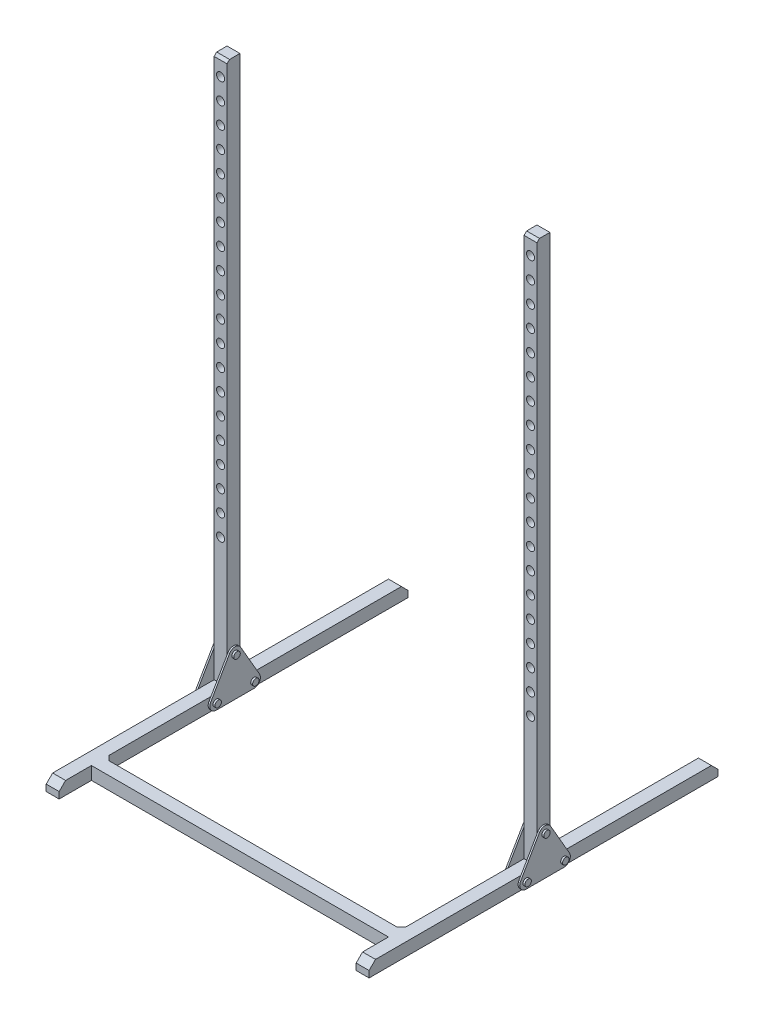
from build123d import *

# Parameters (mm, degrees)
SKETCH1_W                = 50.8
SKETCH1_H                = 50.8
BOSS_EXTRUDE1_DEPTH      = 1371.6
SKETCH2_W                = 50.8
SKETCH2_H                = 50.8
BOSS_EXTRUDE2_DEPTH      = 1168.4
SKETCH3_W                = 50.8
SKETCH3_H                = 50.8
BOSS_EXTRUDE3_DEPTH      = 2133.6
BOSS_EXTRUDE4_DEPTH      = 6.35
FILLET1_R                = 25.4
FILLET2_R                = 25.4
MIRROR4_COPY_1_DEPTH     = 6.35
FILLET3_R                = 25.4
CHAMFER1_SIZE            = 25.24
CHAMFER2_SIZE            = 17.62
SKETCH7_R                = 15.875
CUT_EXTRUDE1_DEPTH       = 2595.602540371
LPATTERN1_COUNT          = 20
LPATTERN1_PITCH          = 82.55
MIRROR5_COPY_1_SKETCH_R  = 15.875
MIRROR5_COPY_1_DEPTH     = 2595.602540371
MIRROR5_COPY_2_SKETCH_R  = 15.875
MIRROR5_COPY_2_DEPTH     = 2595.602540371
MIRROR5_COPY_3_SKETCH_R  = 15.875
MIRROR5_COPY_3_DEPTH     = 2595.602540371
MIRROR5_COPY_4_SKETCH_R  = 15.875
MIRROR5_COPY_4_DEPTH     = 2595.602540371
MIRROR5_COPY_5_SKETCH_R  = 15.875
MIRROR5_COPY_5_DEPTH     = 2595.602540371
MIRROR5_COPY_6_SKETCH_R  = 15.875
MIRROR5_COPY_6_DEPTH     = 2595.602540371
MIRROR5_COPY_7_SKETCH_R  = 15.875
MIRROR5_COPY_7_DEPTH     = 2595.602540371
MIRROR5_COPY_8_SKETCH_R  = 15.875
MIRROR5_COPY_8_DEPTH     = 2595.602540371
MIRROR5_COPY_9_SKETCH_R  = 15.875
MIRROR5_COPY_9_DEPTH     = 2595.602540371
MIRROR5_COPY_10_SKETCH_R = 15.875
MIRROR5_COPY_10_DEPTH    = 2595.602540371
MIRROR5_COPY_11_SKETCH_R = 15.875
MIRROR5_COPY_11_DEPTH    = 2595.602540371
MIRROR5_COPY_12_SKETCH_R = 15.875
MIRROR5_COPY_12_DEPTH    = 2595.602540371
MIRROR5_COPY_13_SKETCH_R = 15.875
MIRROR5_COPY_13_DEPTH    = 2595.602540371
MIRROR5_COPY_14_SKETCH_R = 15.875
MIRROR5_COPY_14_DEPTH    = 2595.602540371
MIRROR5_COPY_15_SKETCH_R = 15.875
MIRROR5_COPY_15_DEPTH    = 2595.602540371
MIRROR5_COPY_16_SKETCH_R = 15.875
MIRROR5_COPY_16_DEPTH    = 2595.602540371
MIRROR5_COPY_17_SKETCH_R = 15.875
MIRROR5_COPY_17_DEPTH    = 2595.602540371
MIRROR5_COPY_18_SKETCH_R = 15.875
MIRROR5_COPY_18_DEPTH    = 2595.602540371
MIRROR5_COPY_19_SKETCH_R = 15.875
MIRROR5_COPY_19_DEPTH    = 2595.602540371
SKETCH8_R                = 12.7
BOSS_EXTRUDE5_DEPTH      = 7.62
MIRROR7_COPY_1_SKETCH_R  = 12.7
MIRROR7_COPY_1_DEPTH     = 7.62
CHAMFER3_SIZE            = 10


with BuildPart() as part:
    # Sketch1 → Boss-Extrude1 (new body)
    with BuildSketch(Plane.XY):
        Rectangle(SKETCH1_W, SKETCH1_H)
    boss_extrude1 = extrude(amount=BOSS_EXTRUDE1_DEPTH)

    # Sketch2 → Boss-Extrude2 (add)
    with BuildSketch(Plane(origin=(25.4, 0, 0), x_dir=(0, 0, -1), z_dir=(1, 0, 0))):
        with Locations((-1219.228406196, 0)):
            Rectangle(SKETCH2_W, SKETCH2_H)
    extrude(amount=BOSS_EXTRUDE2_DEPTH)

    # Mirror1: Boss-Extrude1 across plane
    add(boss_extrude1.mirror(Plane(origin=(609.6, 0, 0), x_dir=(0, 0, 1), z_dir=(1, 0, 0))))

    # Sketch3 → Boss-Extrude3 (add)
    with BuildSketch(Plane(origin=(0, 25.4, 0), x_dir=(1, 0, 0), z_dir=(0, 1, 0))):
        with Locations((0, -685.8)):
            Rectangle(SKETCH3_W, SKETCH3_H)
    boss_extrude3 = extrude(amount=BOSS_EXTRUDE3_DEPTH)

    # Sketch4 → Boss-Extrude4 (add)
    with BuildSketch(Plane.ZY.offset(25.4)):
        Polygon((597.014082897, 25.4), (567.684689222, -25.4), (803.915310778, -25.4), (774.585917103, 25.4), (711.2, 25.4), (711.2, 135.187628907), (685.8, 179.181719419), (660.4, 135.187628907), (660.4, 25.4), align=None)
        Polygon((660.4, 135.187628907), (597.014082897, 25.4), (660.4, 25.4), align=None)
        Polygon((711.2, 25.4), (774.585917103, 25.4), (711.2, 135.187628907), align=None)
    boss_extrude4 = extrude(amount=BOSS_EXTRUDE4_DEPTH)

    # Fillet1
    fillet1_edges = [part.edges().sort_by_distance(p)[0] for p in [
        (-28.575, -25.4, 803.915310778),
        (-28.575, 179.181719419, 685.8),
        (-28.575, -25.4, 567.684689222),
    ]]
    fillet(fillet1_edges, radius=FILLET1_R)

    # Mirror2: Boss-Extrude4 across plane
    add(boss_extrude4.mirror(Plane(origin=(0, 0, 0), x_dir=(0, 0, 1), z_dir=(1, 0, 0))))

    # Fillet2
    fillet2_edges = [part.edges().sort_by_distance(p)[0] for p in [
        (28.575, 179.181719419, 685.8),
        (28.575, -25.4, 803.915310778),
        (28.575, -25.4, 567.684689222),
    ]]
    fillet(fillet2_edges, radius=FILLET2_R)

    # Mirror4: Boss-Extrude3, Boss-Extrude4 across plane
    add(boss_extrude3.mirror(Plane(origin=(609.6, 0, 0), x_dir=(0, 0, 1), z_dir=(1, 0, 0))))
    add(boss_extrude4.mirror(Plane(origin=(609.6, 0, 0), x_dir=(0, 0, 1), z_dir=(1, 0, 0))))

    # Mirror4 copy 1 sketch → Mirror4 copy 1 (add)
    with BuildSketch(Plane.ZY.offset(-1193.8)):
        Polygon((597.014082897, 25.4), (567.684689222, -25.4), (803.915310778, -25.4), (774.585917103, 25.4), (711.2, 25.4), (711.2, 135.187628907), (685.8, 179.181719419), (660.4, 135.187628907), (660.4, 25.4), align=None)
        Polygon((660.4, 135.187628907), (597.014082897, 25.4), (660.4, 25.4), align=None)
        Polygon((711.2, 25.4), (774.585917103, 25.4), (711.2, 135.187628907), align=None)
    extrude(amount=MIRROR4_COPY_1_DEPTH)

    # Fillet3
    fillet3_edges = [part.edges().sort_by_distance(p)[0] for p in [
        (1247.775, 179.181719419, 685.8),
        (1247.775, -25.4, 803.915310778),
        (1247.775, -25.4, 567.684689222),
        (1190.625, -25.4, 803.915310778),
        (1190.625, 179.181719419, 685.8),
        (1190.625, -25.4, 567.684689222),
    ]]
    fillet(fillet3_edges, radius=FILLET3_R)

    # Chamfer1
    chamfer1_edges = [part.edges().sort_by_distance(p)[0] for p in [
        (1219.2, 25.4, 1371.6),
        (1219.2, 25.4, 0),
        (0, 25.4, 0),
        (0, 25.4, 1371.6),
    ]]
    chamfer(chamfer1_edges, length=CHAMFER1_SIZE)

    # Chamfer2
    chamfer2_edges = [part.edges().sort_by_distance(p)[0] for p in [
        (25.4, 0, 1193.828406196),
        (1193.8, 0, 1193.828406196),
    ]]
    chamfer(chamfer2_edges, length=CHAMFER2_SIZE)

    # Sketch7 → Cut-Extrude1 (cut, through all)
    with BuildSketch(Plane(origin=(0, 0, 660.4), x_dir=(-1, 0, 0), z_dir=(0, 0, -1))):
        with Locations((0, 2092.325)):
            Circle(SKETCH7_R)
    cut_extrude1 = extrude(amount=-CUT_EXTRUDE1_DEPTH, mode=Mode.SUBTRACT)

    # LPattern1: Cut-Extrude1 ×20
    with Locations(*[(0, -i * LPATTERN1_PITCH, 0) for i in range(1, LPATTERN1_COUNT)]):
        add(cut_extrude1, mode=Mode.SUBTRACT)

    # Mirror5: Cut-Extrude1 across plane
    add(cut_extrude1.mirror(Plane(origin=(609.6, 0, 0), x_dir=(0, 0, 1), z_dir=(1, 0, 0))), mode=Mode.SUBTRACT)

    # Mirror5 copy 1 sketch → Mirror5 copy 1 (cut, through all)
    with BuildSketch(Plane(origin=(1219.2, -82.55, 660.4), x_dir=(1, 0, 0), z_dir=(0, 0, -1))):
        with Locations((0, -2092.325)):
            Circle(MIRROR5_COPY_1_SKETCH_R)
    extrude(amount=-MIRROR5_COPY_1_DEPTH, mode=Mode.SUBTRACT)

    # Mirror5 copy 2 sketch → Mirror5 copy 2 (cut, through all)
    with BuildSketch(Plane(origin=(1219.2, -165.1, 660.4), x_dir=(1, 0, 0), z_dir=(0, 0, -1))):
        with Locations((0, -2092.325)):
            Circle(MIRROR5_COPY_2_SKETCH_R)
    extrude(amount=-MIRROR5_COPY_2_DEPTH, mode=Mode.SUBTRACT)

    # Mirror5 copy 3 sketch → Mirror5 copy 3 (cut, through all)
    with BuildSketch(Plane(origin=(1219.2, -247.65, 660.4), x_dir=(1, 0, 0), z_dir=(0, 0, -1))):
        with Locations((0, -2092.325)):
            Circle(MIRROR5_COPY_3_SKETCH_R)
    extrude(amount=-MIRROR5_COPY_3_DEPTH, mode=Mode.SUBTRACT)

    # Mirror5 copy 4 sketch → Mirror5 copy 4 (cut, through all)
    with BuildSketch(Plane(origin=(1219.2, -330.2, 660.4), x_dir=(1, 0, 0), z_dir=(0, 0, -1))):
        with Locations((0, -2092.325)):
            Circle(MIRROR5_COPY_4_SKETCH_R)
    extrude(amount=-MIRROR5_COPY_4_DEPTH, mode=Mode.SUBTRACT)

    # Mirror5 copy 5 sketch → Mirror5 copy 5 (cut, through all)
    with BuildSketch(Plane(origin=(1219.2, -412.75, 660.4), x_dir=(1, 0, 0), z_dir=(0, 0, -1))):
        with Locations((0, -2092.325)):
            Circle(MIRROR5_COPY_5_SKETCH_R)
    extrude(amount=-MIRROR5_COPY_5_DEPTH, mode=Mode.SUBTRACT)

    # Mirror5 copy 6 sketch → Mirror5 copy 6 (cut, through all)
    with BuildSketch(Plane(origin=(1219.2, -495.3, 660.4), x_dir=(1, 0, 0), z_dir=(0, 0, -1))):
        with Locations((0, -2092.325)):
            Circle(MIRROR5_COPY_6_SKETCH_R)
    extrude(amount=-MIRROR5_COPY_6_DEPTH, mode=Mode.SUBTRACT)

    # Mirror5 copy 7 sketch → Mirror5 copy 7 (cut, through all)
    with BuildSketch(Plane(origin=(1219.2, -577.85, 660.4), x_dir=(1, 0, 0), z_dir=(0, 0, -1))):
        with Locations((0, -2092.325)):
            Circle(MIRROR5_COPY_7_SKETCH_R)
    extrude(amount=-MIRROR5_COPY_7_DEPTH, mode=Mode.SUBTRACT)

    # Mirror5 copy 8 sketch → Mirror5 copy 8 (cut, through all)
    with BuildSketch(Plane(origin=(1219.2, -660.4, 660.4), x_dir=(1, 0, 0), z_dir=(0, 0, -1))):
        with Locations((0, -2092.325)):
            Circle(MIRROR5_COPY_8_SKETCH_R)
    extrude(amount=-MIRROR5_COPY_8_DEPTH, mode=Mode.SUBTRACT)

    # Mirror5 copy 9 sketch → Mirror5 copy 9 (cut, through all)
    with BuildSketch(Plane(origin=(1219.2, -742.95, 660.4), x_dir=(1, 0, 0), z_dir=(0, 0, -1))):
        with Locations((0, -2092.325)):
            Circle(MIRROR5_COPY_9_SKETCH_R)
    extrude(amount=-MIRROR5_COPY_9_DEPTH, mode=Mode.SUBTRACT)

    # Mirror5 copy 10 sketch → Mirror5 copy 10 (cut, through all)
    with BuildSketch(Plane(origin=(1219.2, -825.5, 660.4), x_dir=(1, 0, 0), z_dir=(0, 0, -1))):
        with Locations((0, -2092.325)):
            Circle(MIRROR5_COPY_10_SKETCH_R)
    extrude(amount=-MIRROR5_COPY_10_DEPTH, mode=Mode.SUBTRACT)

    # Mirror5 copy 11 sketch → Mirror5 copy 11 (cut, through all)
    with BuildSketch(Plane(origin=(1219.2, -908.05, 660.4), x_dir=(1, 0, 0), z_dir=(0, 0, -1))):
        with Locations((0, -2092.325)):
            Circle(MIRROR5_COPY_11_SKETCH_R)
    extrude(amount=-MIRROR5_COPY_11_DEPTH, mode=Mode.SUBTRACT)

    # Mirror5 copy 12 sketch → Mirror5 copy 12 (cut, through all)
    with BuildSketch(Plane(origin=(1219.2, -990.6, 660.4), x_dir=(1, 0, 0), z_dir=(0, 0, -1))):
        with Locations((0, -2092.325)):
            Circle(MIRROR5_COPY_12_SKETCH_R)
    extrude(amount=-MIRROR5_COPY_12_DEPTH, mode=Mode.SUBTRACT)

    # Mirror5 copy 13 sketch → Mirror5 copy 13 (cut, through all)
    with BuildSketch(Plane(origin=(1219.2, -1073.15, 660.4), x_dir=(1, 0, 0), z_dir=(0, 0, -1))):
        with Locations((0, -2092.325)):
            Circle(MIRROR5_COPY_13_SKETCH_R)
    extrude(amount=-MIRROR5_COPY_13_DEPTH, mode=Mode.SUBTRACT)

    # Mirror5 copy 14 sketch → Mirror5 copy 14 (cut, through all)
    with BuildSketch(Plane(origin=(1219.2, -1155.7, 660.4), x_dir=(1, 0, 0), z_dir=(0, 0, -1))):
        with Locations((0, -2092.325)):
            Circle(MIRROR5_COPY_14_SKETCH_R)
    extrude(amount=-MIRROR5_COPY_14_DEPTH, mode=Mode.SUBTRACT)

    # Mirror5 copy 15 sketch → Mirror5 copy 15 (cut, through all)
    with BuildSketch(Plane(origin=(1219.2, -1238.25, 660.4), x_dir=(1, 0, 0), z_dir=(0, 0, -1))):
        with Locations((0, -2092.325)):
            Circle(MIRROR5_COPY_15_SKETCH_R)
    extrude(amount=-MIRROR5_COPY_15_DEPTH, mode=Mode.SUBTRACT)

    # Mirror5 copy 16 sketch → Mirror5 copy 16 (cut, through all)
    with BuildSketch(Plane(origin=(1219.2, -1320.8, 660.4), x_dir=(1, 0, 0), z_dir=(0, 0, -1))):
        with Locations((0, -2092.325)):
            Circle(MIRROR5_COPY_16_SKETCH_R)
    extrude(amount=-MIRROR5_COPY_16_DEPTH, mode=Mode.SUBTRACT)

    # Mirror5 copy 17 sketch → Mirror5 copy 17 (cut, through all)
    with BuildSketch(Plane(origin=(1219.2, -1403.35, 660.4), x_dir=(1, 0, 0), z_dir=(0, 0, -1))):
        with Locations((0, -2092.325)):
            Circle(MIRROR5_COPY_17_SKETCH_R)
    extrude(amount=-MIRROR5_COPY_17_DEPTH, mode=Mode.SUBTRACT)

    # Mirror5 copy 18 sketch → Mirror5 copy 18 (cut, through all)
    with BuildSketch(Plane(origin=(1219.2, -1485.9, 660.4), x_dir=(1, 0, 0), z_dir=(0, 0, -1))):
        with Locations((0, -2092.325)):
            Circle(MIRROR5_COPY_18_SKETCH_R)
    extrude(amount=-MIRROR5_COPY_18_DEPTH, mode=Mode.SUBTRACT)

    # Mirror5 copy 19 sketch → Mirror5 copy 19 (cut, through all)
    with BuildSketch(Plane(origin=(1219.2, -1568.45, 660.4), x_dir=(1, 0, 0), z_dir=(0, 0, -1))):
        with Locations((0, -2092.325)):
            Circle(MIRROR5_COPY_19_SKETCH_R)
    extrude(amount=-MIRROR5_COPY_19_DEPTH, mode=Mode.SUBTRACT)

    # Sketch8 → Boss-Extrude5 (add)
    with BuildSketch(Plane.ZY.offset(31.75)):
        with Locations(Location((685.8, 128.381719419, 0), (0, 0, 270))):
            Circle(SKETCH8_R)
        with Locations(Location((611.678779734, 0, 0), (0, 0, 270))):
            Circle(SKETCH8_R)
        with Locations(Location((759.921220266, 0, 0), (0, 0, 270))):
            Circle(SKETCH8_R)
    boss_extrude5 = extrude(amount=BOSS_EXTRUDE5_DEPTH)

    # Mirror6: Boss-Extrude5 across plane
    add(boss_extrude5.mirror(Plane(origin=(0, 0, 0), x_dir=(0, 0, 1), z_dir=(1, 0, 0))))

    # Mirror7: Boss-Extrude5 across plane
    add(boss_extrude5.mirror(Plane(origin=(609.6, 0, 0), x_dir=(0, 0, 1), z_dir=(1, 0, 0))))

    # Mirror7 copy 1 sketch → Mirror7 copy 1 (add)
    with BuildSketch(Plane.ZY.offset(-1187.45)):
        with Locations(Location((685.8, 128.381719419, 0), (0, 0, 270))):
            Circle(MIRROR7_COPY_1_SKETCH_R)
        with Locations(Location((611.678779734, 0, 0), (0, 0, 270))):
            Circle(MIRROR7_COPY_1_SKETCH_R)
        with Locations(Location((759.921220266, 0, 0), (0, 0, 270))):
            Circle(MIRROR7_COPY_1_SKETCH_R)
    extrude(amount=MIRROR7_COPY_1_DEPTH)

    # Chamfer3
    chamfer3_edges = [part.edges().sort_by_distance(p)[0] for p in [
        (1219.2, 2159, 711.2),
        (0, 2159, 711.2),
    ]]
    chamfer(chamfer3_edges, length=CHAMFER3_SIZE)


solid = part.part
